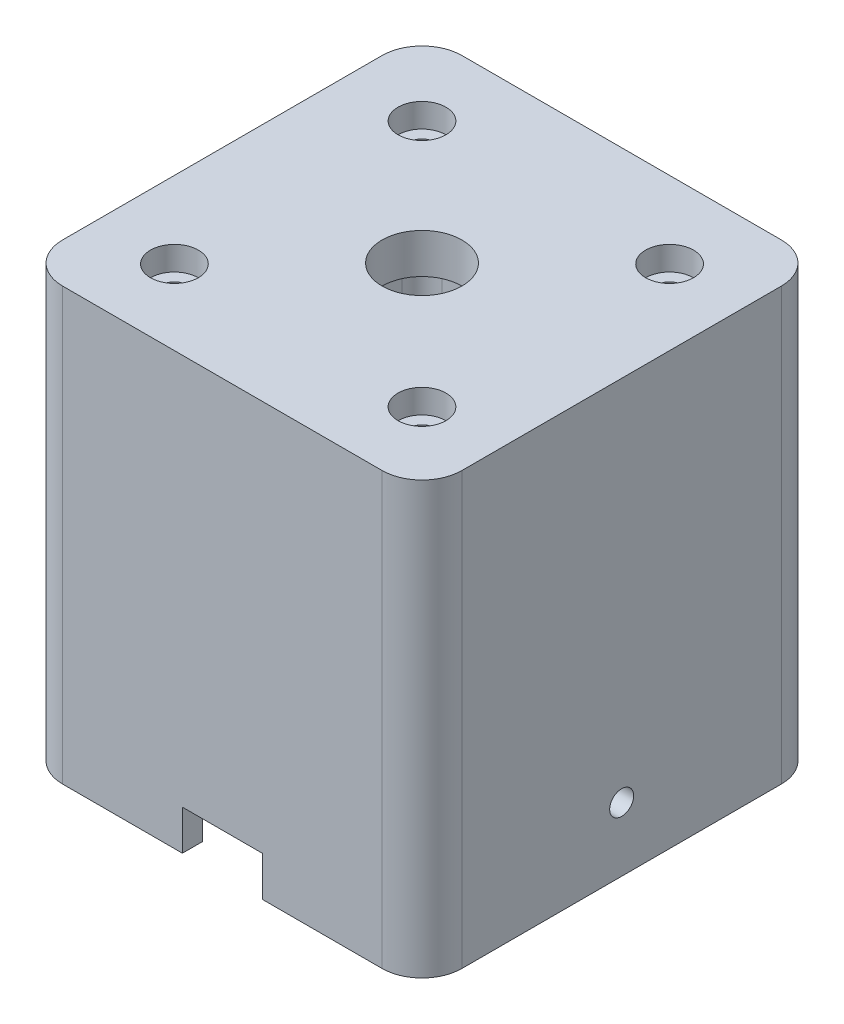
from build123d import *

# Parameters (mm, degrees)
SKETCH1_W           = 50
SKETCH1_H           = 50
SKETCH1_W_2         = 45
SKETCH1_H_2         = 45
BOSS_EXTRUDE1_DEPTH = 47
SKETCH3_W           = 50
SKETCH3_H           = 50
BOSS_EXTRUDE3_DEPTH = 7
SKETCH5_R           = 11.5
CUT_EXTRUDE1_DEPTH  = 2
SKETCH6_R           = 5
CUT_EXTRUDE2_DEPTH  = 61.42350536
FILLET2_R           = 5
FILLET3_R           = 5
FILLET4_R           = 5
FILLET5_R           = 5
FILLET7_R           = 2.5
FILLET8_R           = 2.5
FILLET9_R           = 2.5
FILLET10_R          = 2.5
SKETCH9_W           = 10
SKETCH9_H           = 5
CUT_EXTRUDE5_DEPTH  = 13
SKETCH10_R          = 1.5
CUT_EXTRUDE6_DEPTH  = 10
CIRPATTERN1_COUNT   = 4
HOLE1_D             = 3
HOLE1_DEPTH         = 12
HOLE1_CBORE_D       = 6
HOLE1_CBORE_DEPTH   = 3


with BuildPart() as part:
    # Sketch1 → Boss-Extrude1 (new body)
    with BuildSketch(Plane(origin=(0, 0, 0), x_dir=(1, 0, 0), z_dir=(0, 1, 0))):
        Rectangle(SKETCH1_W, SKETCH1_H)
        Rectangle(SKETCH1_W_2, SKETCH1_H_2, mode=Mode.SUBTRACT)
    extrude(amount=BOSS_EXTRUDE1_DEPTH)

    # Sketch3 → Boss-Extrude3 (add)
    with BuildSketch(Plane(origin=(0, 47, 0), x_dir=(1, 0, 0), z_dir=(0, 1, 0))):
        Rectangle(SKETCH3_W, SKETCH3_H)
    extrude(amount=BOSS_EXTRUDE3_DEPTH)

    # Sketch5 → Cut-Extrude1 (cut)
    with BuildSketch(Plane.XZ.offset(-47)):
        with Locations(Location((0, 0, 0), (0, 0, 270))):
            Circle(SKETCH5_R)
    extrude(amount=-CUT_EXTRUDE1_DEPTH, mode=Mode.SUBTRACT)

    # Sketch6 → Cut-Extrude2 (cut, through all)
    with BuildSketch(Plane.XZ.offset(-49)):
        with Locations(Location((0, 0, 0), (0, 0, 270))):
            Circle(SKETCH6_R)
    extrude(amount=-CUT_EXTRUDE2_DEPTH, mode=Mode.SUBTRACT)

    # Fillet2
    fillet2_edges = [part.edges().sort_by_distance(p)[0] for p in [
        (25, 27, 25),
    ]]
    fillet(fillet2_edges, radius=FILLET2_R)

    # Fillet3
    fillet3_edges = [part.edges().sort_by_distance(p)[0] for p in [
        (25, 27, -25),
    ]]
    fillet(fillet3_edges, radius=FILLET3_R)

    # Fillet4
    fillet4_edges = [part.edges().sort_by_distance(p)[0] for p in [
        (-25, 27, -25),
    ]]
    fillet(fillet4_edges, radius=FILLET4_R)

    # Fillet5
    fillet5_edges = [part.edges().sort_by_distance(p)[0] for p in [
        (-25, 27, 25),
    ]]
    fillet(fillet5_edges, radius=FILLET5_R)

    # Fillet7
    fillet7_edges = [part.edges().sort_by_distance(p)[0] for p in [
        (-22.5, 23.5, 22.5),
    ]]
    fillet(fillet7_edges, radius=FILLET7_R)

    # Fillet8
    fillet8_edges = [part.edges().sort_by_distance(p)[0] for p in [
        (22.5, 23.5, 22.5),
    ]]
    fillet(fillet8_edges, radius=FILLET8_R)

    # Fillet9
    fillet9_edges = [part.edges().sort_by_distance(p)[0] for p in [
        (22.5, 23.5, -22.5),
    ]]
    fillet(fillet9_edges, radius=FILLET9_R)

    # Fillet10
    fillet10_edges = [part.edges().sort_by_distance(p)[0] for p in [
        (-22.5, 23.5, -22.5),
    ]]
    fillet(fillet10_edges, radius=FILLET10_R)

    # Sketch9 → Cut-Extrude5 (cut)
    with BuildSketch(Plane.XY.offset(25)):
        with Locations((0, 2.5)):
            Rectangle(SKETCH9_W, SKETCH9_H)
    extrude(amount=-CUT_EXTRUDE5_DEPTH, mode=Mode.SUBTRACT)

    # Sketch10 → Cut-Extrude6 (cut)
    with BuildSketch(Plane(origin=(25, 0, 0), x_dir=(0, 0, -1), z_dir=(1, 0, 0))):
        with Locations((0, 8)):
            Circle(SKETCH10_R)
    cut_extrude6 = extrude(amount=-CUT_EXTRUDE6_DEPTH, mode=Mode.SUBTRACT)

    # CirPattern1: Cut-Extrude6 ×4 about axis, 1 skipped
    cirpattern1_axis = Axis((0, 54, 0), (0, -1, 0))
    add([cut_extrude6.rotate(cirpattern1_axis, i * 360 / CIRPATTERN1_COUNT) for i in range(1, CIRPATTERN1_COUNT) if i not in (1,)], mode=Mode.SUBTRACT)

    # Hole1
    with Locations(Plane(origin=(-15.4, 54, -15.4), x_dir=(0, 0, 1), z_dir=(0, 1, 0))):
        with Locations((0, 0), (0, 31), (31, 31), (31, 0)):
            CounterBoreHole(HOLE1_D / 2, HOLE1_CBORE_D / 2, HOLE1_CBORE_DEPTH, depth=HOLE1_DEPTH)


solid = part.part
